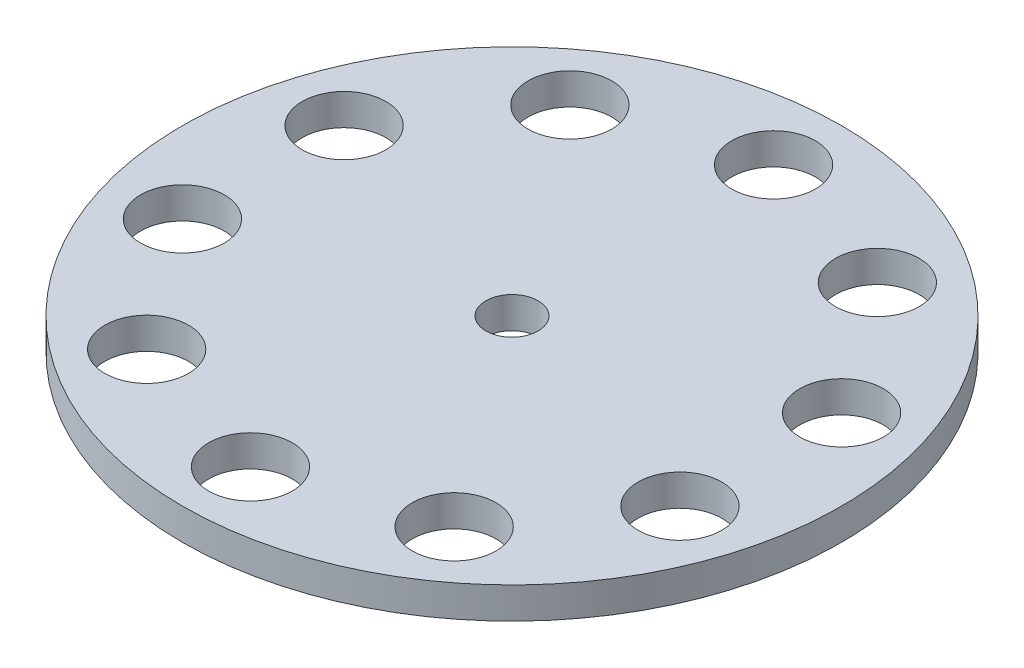
from build123d import *

# Parameters (mm, degrees)
SKETCH1_R           = 31.5
SKETCH1_R_2         = 4
SKETCH1_R_3         = 2.5
BOSS_EXTRUDE1_DEPTH = 3


with BuildPart() as part:
    # Sketch1 → Boss-Extrude1 (new body)
    with BuildSketch(Plane(origin=(0, 0, 0), x_dir=(1, 0, 0), z_dir=(0, 1, 0))):
        with Locations(Location((0, 0, 0), (0, 0, 270))):
            Circle(SKETCH1_R)
        with Locations(Location((0, 25, 0), (0, 0, 270))):
            Circle(SKETCH1_R_2, mode=Mode.SUBTRACT)
        with Locations(Location((14.694631307, 20.225424859, 0), (0, 0, 270))):
            Circle(SKETCH1_R_2, mode=Mode.SUBTRACT)
        with Locations(Location((23.776412907, 7.725424859, 0), (0, 0, 270))):
            Circle(SKETCH1_R_2, mode=Mode.SUBTRACT)
        with Locations(Location((23.776412907, -7.725424859, 0), (0, 0, 270))):
            Circle(SKETCH1_R_2, mode=Mode.SUBTRACT)
        with Locations(Location((14.694631307, -20.225424859, 0), (0, 0, 270))):
            Circle(SKETCH1_R_2, mode=Mode.SUBTRACT)
        with Locations(Location((0, -25, 0), (0, 0, 270))):
            Circle(SKETCH1_R_2, mode=Mode.SUBTRACT)
        with Locations(Location((-14.694631307, -20.225424859, 0), (0, 0, 270))):
            Circle(SKETCH1_R_2, mode=Mode.SUBTRACT)
        with Locations(Location((-23.776412907, -7.725424859, 0), (0, 0, 270))):
            Circle(SKETCH1_R_2, mode=Mode.SUBTRACT)
        with Locations(Location((-23.776412907, 7.725424859, 0), (0, 0, 270))):
            Circle(SKETCH1_R_2, mode=Mode.SUBTRACT)
        with Locations(Location((-14.694631307, 20.225424859, 0), (0, 0, 270))):
            Circle(SKETCH1_R_2, mode=Mode.SUBTRACT)
        with Locations(Location((0, 0, 0), (0, 0, 270))):
            Circle(SKETCH1_R_3, mode=Mode.SUBTRACT)
    extrude(amount=BOSS_EXTRUDE1_DEPTH)


solid = part.part
